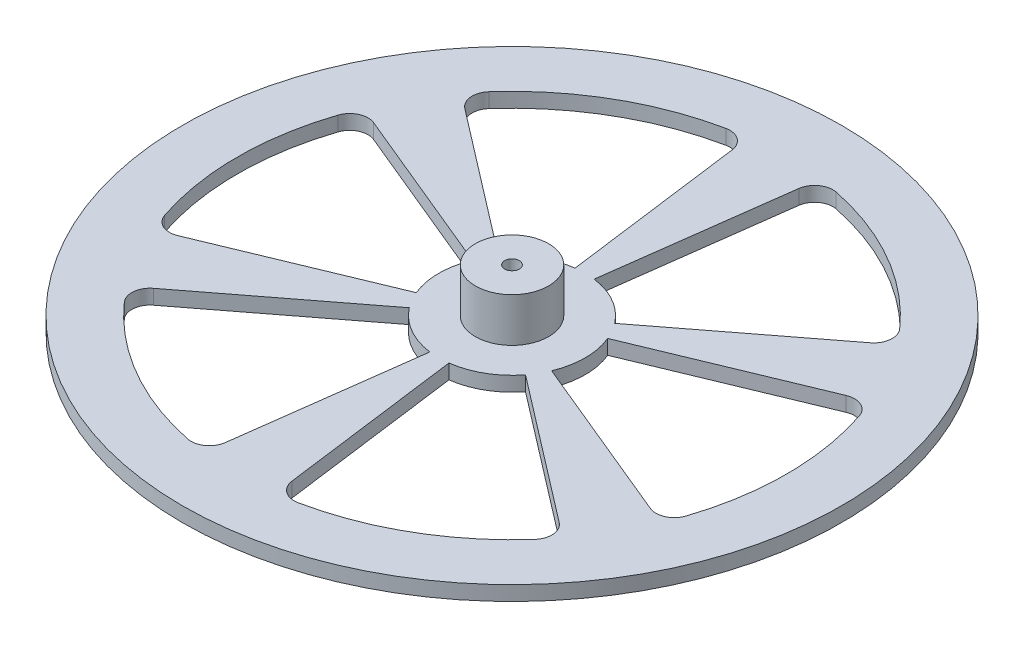
from build123d import *

# Parameters (mm, degrees)
SKETCH_1_R               = 90
EXTRUDE_1_DEPTH          = 4
CUT_EXTRUDE_1_DEPTH      = 128.342059038
PATTERN_CIRCULAR_1_COUNT = 6
SKETCH_6_R               = 10
EXTRUDE_2_DEPTH          = 12
SKETCH_7_R               = 2
CUT_EXTRUDE_2_DEPTH      = 12
FILLET_1_R               = 5
FILLET_2_R               = 5
SKETCH_9_R               = 2
CUT_EXTRUDE_3_DEPTH      = 10


with BuildPart() as part:
    # 草图1 → 凸台-拉伸1 (new body)
    with BuildSketch(Plane(origin=(0, 0, 0), x_dir=(1, 0, 0), z_dir=(0, 1, 0))):
        Circle(SKETCH_1_R)
    extrude(amount=EXTRUDE_1_DEPTH)

    # 草图2 → 切除-拉伸1 (cut, through all)
    with BuildSketch(Plane(origin=(0, 4, 0), x_dir=(1, 0, 0), z_dir=(0, 1, 0))):
        with BuildLine():
            ThreePointArc((-15.867066806, 12.17522858), (-10, 17.320508076), (-2.610523844, 19.828897227))
            Line((-2.610523844, 19.828897227), (-9.789464417, 74.358364603))
            ThreePointArc((-9.789464417, 74.358364603), (-37.5, 64.951905284), (-59.501500522, 45.657107176))
            Line((-59.501500522, 45.657107176), (-15.867066806, 12.17522858))
        make_face()
    cut_extrude_1 = extrude(amount=-CUT_EXTRUDE_1_DEPTH, mode=Mode.SUBTRACT)

    # 阵列(圆周)1: 切除-拉伸1 ×6 about axis
    pattern_circular_1_axis = Axis((0, 4, 0), (0, 1, 0))
    for i in range(1, PATTERN_CIRCULAR_1_COUNT):
        add(cut_extrude_1.rotate(pattern_circular_1_axis, i * 360 / PATTERN_CIRCULAR_1_COUNT), mode=Mode.SUBTRACT)

    # 草图6 → 凸台-拉伸2 (add)
    with BuildSketch(Plane(origin=(0, 4, 0), x_dir=(1, 0, 0), z_dir=(0, 1, 0))):
        Circle(SKETCH_6_R)
    extrude(amount=EXTRUDE_2_DEPTH)

    # 草图7 → 切除-拉伸2 (cut)
    with BuildSketch(Plane(origin=(0, 16, 0), x_dir=(1, 0, 0), z_dir=(0, 1, 0))):
        Circle(SKETCH_7_R)
    extrude(amount=-CUT_EXTRUDE_2_DEPTH, mode=Mode.SUBTRACT)

    # 圆角1
    fillet_1_edges = [part.edges().sort_by_distance(p)[0] for p in [
        (9.789464417, 2, 74.358364603),
    ]]
    fillet(fillet_1_edges, radius=FILLET_1_R)

    # 圆角2
    fillet_2_edges = [part.edges().sort_by_distance(p)[0] for p in [
        (-59.501500522, 2, 45.657107176),
        (-9.789464417, 2, 74.358364603),
        (-69.290964938, 2, 28.701257427),
        (-69.290964938, 2, -28.701257427),
        (-9.789464417, 2, -74.358364603),
        (-59.501500522, 2, -45.657107176),
        (9.789464417, 2, -74.358364603),
        (59.501500522, 2, -45.657107176),
        (69.290964938, 2, -28.701257427),
        (69.290964938, 2, 28.701257427),
        (59.501500522, 2, 45.657107176),
    ]]
    fillet(fillet_2_edges, radius=FILLET_2_R)

    # 草图9 → 切除-拉伸3 (cut)
    with BuildSketch(Plane(origin=(0, 0, 0), x_dir=(0, 0, -1), z_dir=(1, 0, 0))):
        with Locations((0, 11)):
            Circle(SKETCH_9_R)
    extrude(amount=-CUT_EXTRUDE_3_DEPTH, mode=Mode.SUBTRACT)


solid = part.part
